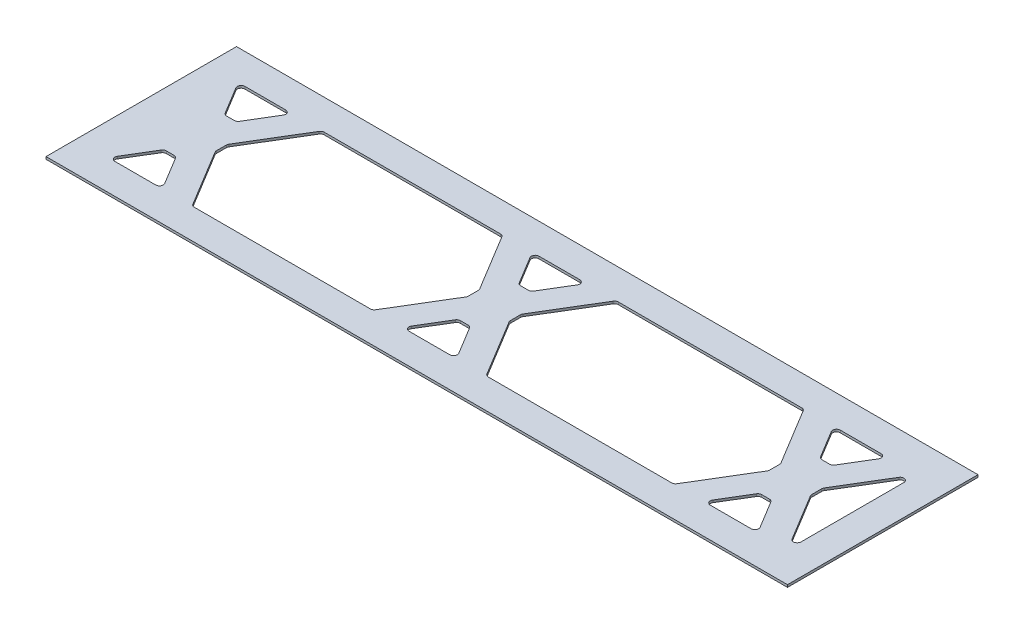
from build123d import *

# Parameters (mm, degrees)
SKETCH1_W           = 311.15
SKETCH1_H           = 79.948192099
BOSS_EXTRUDE1_DEPTH = 1


with BuildPart() as part:
    # Sketch1 → Boss-Extrude1 (new body)
    with BuildSketch(Plane(origin=(0, 0, 0), x_dir=(1, 0, 0), z_dir=(0, 1, 0))):
        with Locations((155.575, 39.97409605)):
            Rectangle(SKETCH1_W, SKETCH1_H)
        with BuildLine():
            Line((16.217864357, 67.248192099), (33.342821045, 67.248192099))
            ThreePointArc((33.342821045, 67.248192099), (34.725807369, 66.44011822), (34.70085023, 64.838552828))
            Line((34.70085023, 64.838552828), (27.77241501, 53.39399889))
            ThreePointArc((27.77241501, 53.39399889), (27.193811945, 52.833151838), (26.414385824, 52.628638162))
            Line((26.414385824, 52.628638162), (23.146299578, 52.628638162))
            ThreePointArc((23.146299578, 52.628638162), (22.366873457, 52.833151838), (21.788270393, 53.39399889))
            Line((21.788270393, 53.39399889), (14.859835172, 64.838552828))
            ThreePointArc((14.859835172, 64.838552828), (14.834878034, 66.44011822), (16.217864357, 67.248192099))
        make_face(mode=Mode.SUBTRACT)
        with BuildLine():
            Line((49.506215761, 67.248192099), (123.456467253, 67.248192099))
            ThreePointArc((123.456467253, 67.248192099), (124.235893374, 67.043678423), (124.814496439, 66.482831371))
            Line((124.814496439, 66.482831371), (139.102316391, 42.881870854))
            ThreePointArc((139.102316391, 42.881870854), (139.273343709, 42.486513094), (139.331787206, 42.059731582))
            Line((139.331787206, 42.059731582), (139.331787206, 37.888460517))
            ThreePointArc((139.331787206, 37.888460517), (139.273343709, 37.461679005), (139.102316391, 37.066321246))
            Line((139.102316391, 37.066321246), (124.814496439, 13.465360728))
            ThreePointArc((124.814496439, 13.465360728), (124.235893374, 12.904513676), (123.456467253, 12.7))
            Line((123.456467253, 12.7), (49.506215761, 12.7))
            ThreePointArc((49.506215761, 12.7), (48.72678964, 12.904513676), (48.148186576, 13.465360728))
            Line((48.148186576, 13.465360728), (33.860366623, 37.066321246))
            ThreePointArc((33.860366623, 37.066321246), (33.689339305, 37.461679005), (33.630895809, 37.888460517))
            Line((33.630895809, 37.888460517), (33.630895809, 42.059731582))
            ThreePointArc((33.630895809, 42.059731582), (33.689339305, 42.486513094), (33.860366623, 42.881870854))
            Line((33.860366623, 42.881870854), (48.148186576, 66.482831371))
            ThreePointArc((48.148186576, 66.482831371), (48.72678964, 67.043678423), (49.506215761, 67.248192099))
        make_face(mode=Mode.SUBTRACT)
        with BuildLine():
            Line((266.056334932, 67.248192099), (283.18129162, 67.248192099))
            ThreePointArc((283.18129162, 67.248192099), (284.564277944, 66.44011822), (284.539320806, 64.838552828))
            Line((284.539320806, 64.838552828), (277.610885585, 53.39399889))
            ThreePointArc((277.610885585, 53.39399889), (277.03228252, 52.833151838), (276.252856399, 52.628638162))
            Line((276.252856399, 52.628638162), (272.984770153, 52.628638162))
            ThreePointArc((272.984770153, 52.628638162), (272.205344032, 52.833151838), (271.626740968, 53.39399889))
            Line((271.626740968, 53.39399889), (264.698305747, 64.838552828))
            ThreePointArc((264.698305747, 64.838552828), (264.673348609, 66.44011822), (266.056334932, 67.248192099))
        make_face(mode=Mode.SUBTRACT)
        with BuildLine():
            Line((16.217864357, 12.7), (33.342821045, 12.7))
            ThreePointArc((33.342821045, 12.7), (34.725807369, 13.508073879), (34.70085023, 15.109639272))
            Line((34.70085023, 15.109639272), (27.77241501, 26.554193209))
            ThreePointArc((27.77241501, 26.554193209), (27.193811945, 27.115040261), (26.414385824, 27.319553938))
            Line((26.414385824, 27.319553938), (23.146299578, 27.319553938))
            ThreePointArc((23.146299578, 27.319553938), (22.366873457, 27.115040261), (21.788270393, 26.554193209))
            Line((21.788270393, 26.554193209), (14.859835172, 15.109639272))
            ThreePointArc((14.859835172, 15.109639272), (14.834878034, 13.508073879), (16.217864357, 12.7))
        make_face(mode=Mode.SUBTRACT)
        with BuildLine():
            Line((139.619861969, 67.248192099), (156.744818657, 67.248192099))
            ThreePointArc((156.744818657, 67.248192099), (158.127804981, 66.44011822), (158.102847842, 64.838552828))
            Line((158.102847842, 64.838552828), (151.174412622, 53.39399889))
            ThreePointArc((151.174412622, 53.39399889), (150.595809557, 52.833151838), (149.816383436, 52.628638162))
            Line((149.816383436, 52.628638162), (146.54829719, 52.628638162))
            ThreePointArc((146.54829719, 52.628638162), (145.768871069, 52.833151838), (145.190268005, 53.39399889))
            Line((145.190268005, 53.39399889), (138.261832784, 64.838552828))
            ThreePointArc((138.261832784, 64.838552828), (138.236875646, 66.44011822), (139.619861969, 67.248192099))
        make_face(mode=Mode.SUBTRACT)
        with BuildLine():
            Line((298.45, 61.560557725), (298.45, 18.387634374))
            ThreePointArc((298.45, 18.387634374), (297.289281512, 16.858577871), (295.504470815, 17.565495103))
            Line((295.504470815, 17.565495103), (283.698837199, 37.066321246))
            ThreePointArc((283.698837199, 37.066321246), (283.52780988, 37.461679005), (283.469366384, 37.888460517))
            Line((283.469366384, 37.888460517), (283.469366384, 42.059731582))
            ThreePointArc((283.469366384, 42.059731582), (283.52780988, 42.486513094), (283.698837199, 42.881870854))
            Line((283.698837199, 42.881870854), (295.504470815, 62.382696997))
            ThreePointArc((295.504470815, 62.382696997), (297.289281512, 63.089614229), (298.45, 61.560557725))
        make_face(mode=Mode.SUBTRACT)
        with BuildLine():
            Line((265.768260169, 37.888460517), (265.768260169, 42.059731582))
            ThreePointArc((265.768260169, 42.059731582), (265.709816672, 42.486513094), (265.538789354, 42.881870854))
            Line((265.538789354, 42.881870854), (251.250969402, 66.482831371))
            ThreePointArc((251.250969402, 66.482831371), (250.672366338, 67.043678423), (249.892940217, 67.248192099))
            Line((249.892940217, 67.248192099), (172.908213373, 67.248192099))
            ThreePointArc((172.908213373, 67.248192099), (172.128787252, 67.043678423), (171.550184188, 66.482831371))
            Line((171.550184188, 66.482831371), (157.262364235, 42.881870854))
            ThreePointArc((157.262364235, 42.881870854), (157.091336917, 42.486513094), (157.032893421, 42.059731582))
            Line((157.032893421, 42.059731582), (157.032893421, 37.888460517))
            ThreePointArc((157.032893421, 37.888460517), (157.091336917, 37.461679005), (157.262364235, 37.066321246))
            Line((157.262364235, 37.066321246), (171.550184188, 13.465360728))
            ThreePointArc((171.550184188, 13.465360728), (172.128787252, 12.904513676), (172.908213373, 12.7))
            Line((172.908213373, 12.7), (249.892940217, 12.7))
            ThreePointArc((249.892940217, 12.7), (250.672366338, 12.904513676), (251.250969402, 13.465360728))
            Line((251.250969402, 13.465360728), (265.538789354, 37.066321246))
            ThreePointArc((265.538789354, 37.066321246), (265.709816672, 37.461679005), (265.768260169, 37.888460517))
        make_face(mode=Mode.SUBTRACT)
        with BuildLine():
            Line((146.54829719, 27.319553938), (149.816383436, 27.319553938))
            ThreePointArc((149.816383436, 27.319553938), (150.595809557, 27.115040261), (151.174412622, 26.554193209))
            Line((151.174412622, 26.554193209), (158.102847842, 15.109639272))
            ThreePointArc((158.102847842, 15.109639272), (158.127804981, 13.508073879), (156.744818657, 12.7))
            Line((156.744818657, 12.7), (139.619861969, 12.7))
            ThreePointArc((139.619861969, 12.7), (138.236875646, 13.508073879), (138.261832784, 15.109639272))
            Line((138.261832784, 15.109639272), (145.190268005, 26.554193209))
            ThreePointArc((145.190268005, 26.554193209), (145.768871069, 27.115040261), (146.54829719, 27.319553938))
        make_face(mode=Mode.SUBTRACT)
        with BuildLine():
            Line((271.626740968, 26.554193209), (264.698305747, 15.109639272))
            ThreePointArc((264.698305747, 15.109639272), (264.673348609, 13.508073879), (266.056334932, 12.7))
            Line((266.056334932, 12.7), (283.18129162, 12.7))
            ThreePointArc((283.18129162, 12.7), (284.564277944, 13.508073879), (284.539320806, 15.109639272))
            Line((284.539320806, 15.109639272), (277.610885585, 26.554193209))
            ThreePointArc((277.610885585, 26.554193209), (277.03228252, 27.115040261), (276.252856399, 27.319553938))
            Line((276.252856399, 27.319553938), (272.984770153, 27.319553938))
            ThreePointArc((272.984770153, 27.319553938), (272.205344032, 27.115040261), (271.626740968, 26.554193209))
        make_face(mode=Mode.SUBTRACT)
    extrude(amount=BOSS_EXTRUDE1_DEPTH)


solid = part.part
